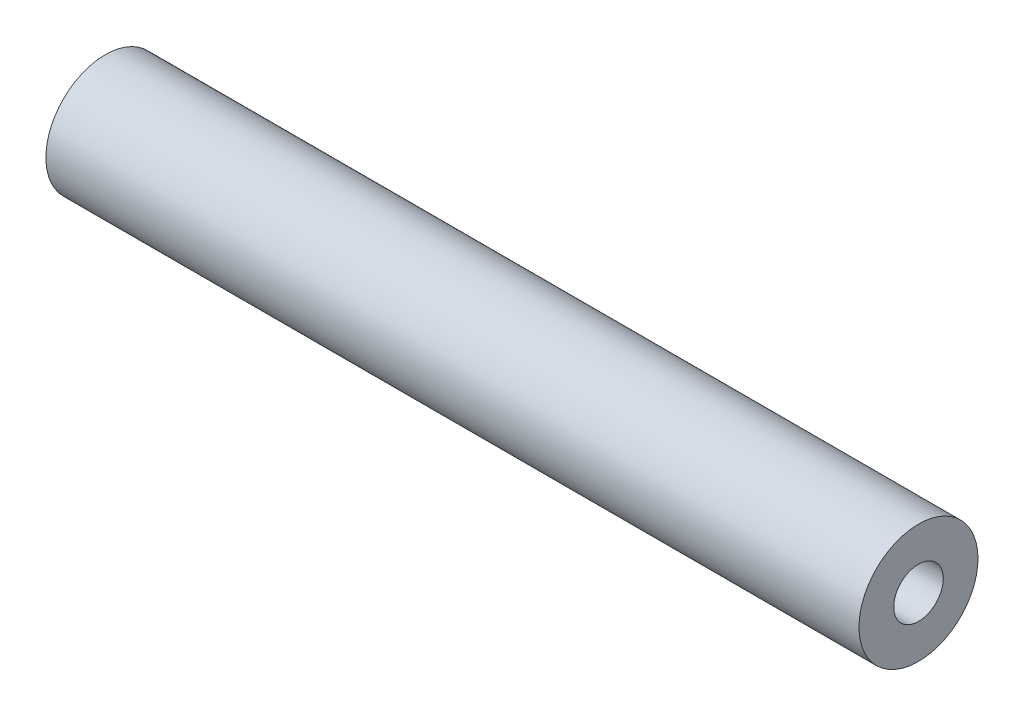
from build123d import *

# Parameters (mm, degrees)
SKETCH1_W          = 41
SKETCH1_H          = 3
SKETCH2_R          = 1.25
CUT_EXTRUDE1_DEPTH = 10


with BuildPart() as part:
    # Sketch1 → Revolve1 (revolve)
    with BuildSketch(Plane(origin=(0, 0, 0), x_dir=(1, 0, 0), z_dir=(0, 1, 0))):
        with Locations((20.5, 1.5)):
            Rectangle(SKETCH1_W, SKETCH1_H)
    revolve(axis=Axis((0, 0, 0), (-1, 0, 0)))

    # Sketch2 → Cut-Extrude1 (cut)
    with BuildSketch(Plane(origin=(41, 0, 0), x_dir=(0, 0, -1), z_dir=(1, 0, 0))):
        Circle(SKETCH2_R)
    extrude(amount=-CUT_EXTRUDE1_DEPTH, mode=Mode.SUBTRACT)


solid = part.part
